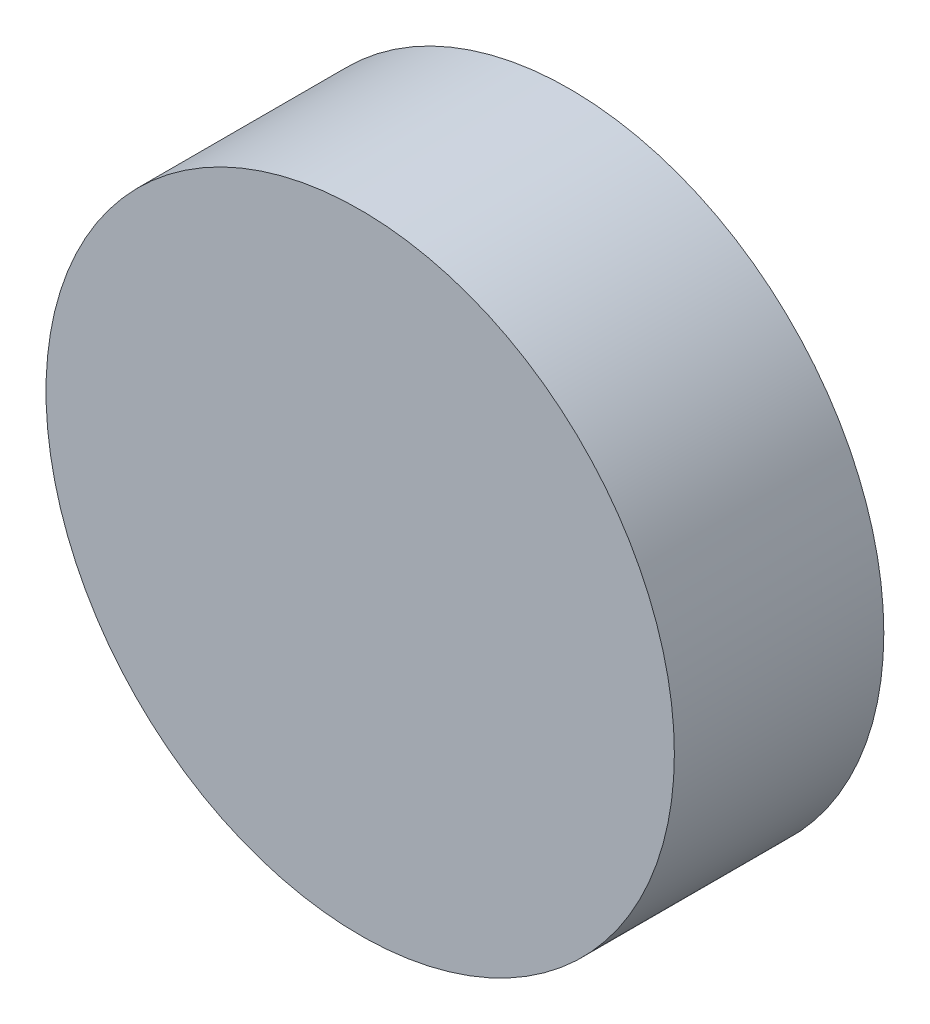
from build123d import *

# Parameters (mm, degrees)
SKETCH_1_R = 7.5
LENS_DEPTH = 5


with BuildPart() as part:
    # 草图1 → Lens (new body)
    with BuildSketch(Plane.XY):
        Circle(SKETCH_1_R)
    extrude(amount=LENS_DEPTH)


solid = part.part
